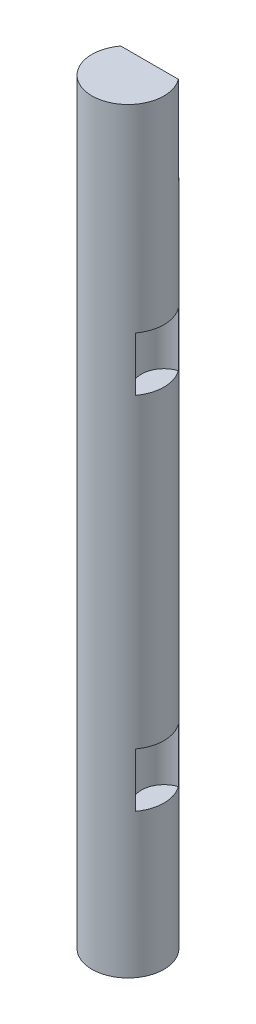
from build123d import *

# Parameters (mm, degrees)
CROQUIS1_R                 = 2
SALIENTE_EXTRUIR1_DEPTH    = 21
CORTAR_EXTRUIR1_DEPTH      = 43.09513036
CORTAR_EXTRUIR1_DEPTH_BACK = 5
CUT_EXTRUDE1_START         = 10
SKETCH2_R                  = 1.25
CUT_EXTRUDE1_DEPTH         = 3
LPATTERN1_COUNT            = 2
LPATTERN1_PITCH            = 20


with BuildPart() as part:
    # Croquis1 → Saliente-Extruir1 (new, symmetric)
    with BuildSketch(Plane(origin=(0, 0, 0), x_dir=(1, 0, 0), z_dir=(0, 1, 0))):
        with Locations(Location((0, 0, 0), (0, 0, 90))):
            Circle(CROQUIS1_R)
    extrude(amount=SALIENTE_EXTRUIR1_DEPTH, both=True)

    # Croquis2 → Cortar-Extruir1 (cut, two sides: drawn at the far end of the back side and taken through both)
    with BuildSketch(Plane(origin=(0, 21, 0), x_dir=(1, 0, 0), z_dir=(0, 1, 0)).offset(-CORTAR_EXTRUIR1_DEPTH_BACK)):
        Polygon((-21.233275663, 1.2), (-1.6, 1.2), (1.6, 1.2), (21.233275663, 1.2), (21.233275663, 40.466551326), (-21.233275663, 40.466551326), align=None)
    extrude(amount=CORTAR_EXTRUIR1_DEPTH + CORTAR_EXTRUIR1_DEPTH_BACK, mode=Mode.SUBTRACT)

    # Sketch2 → Cut-Extrude1 (cut)
    with BuildSketch(Plane(origin=(0, 0, 0), x_dir=(1, 0, 0), z_dir=(0, 1, 0)).offset(CUT_EXTRUDE1_START)):
        with Locations((2, 0)):
            Circle(SKETCH2_R)
    cut_extrude1 = extrude(amount=-CUT_EXTRUDE1_DEPTH, mode=Mode.SUBTRACT)

    # LPattern1: Cut-Extrude1 ×2
    with Locations(*[(0, -i * LPATTERN1_PITCH, 0) for i in range(1, LPATTERN1_COUNT)]):
        add(cut_extrude1, mode=Mode.SUBTRACT)


solid = part.part
